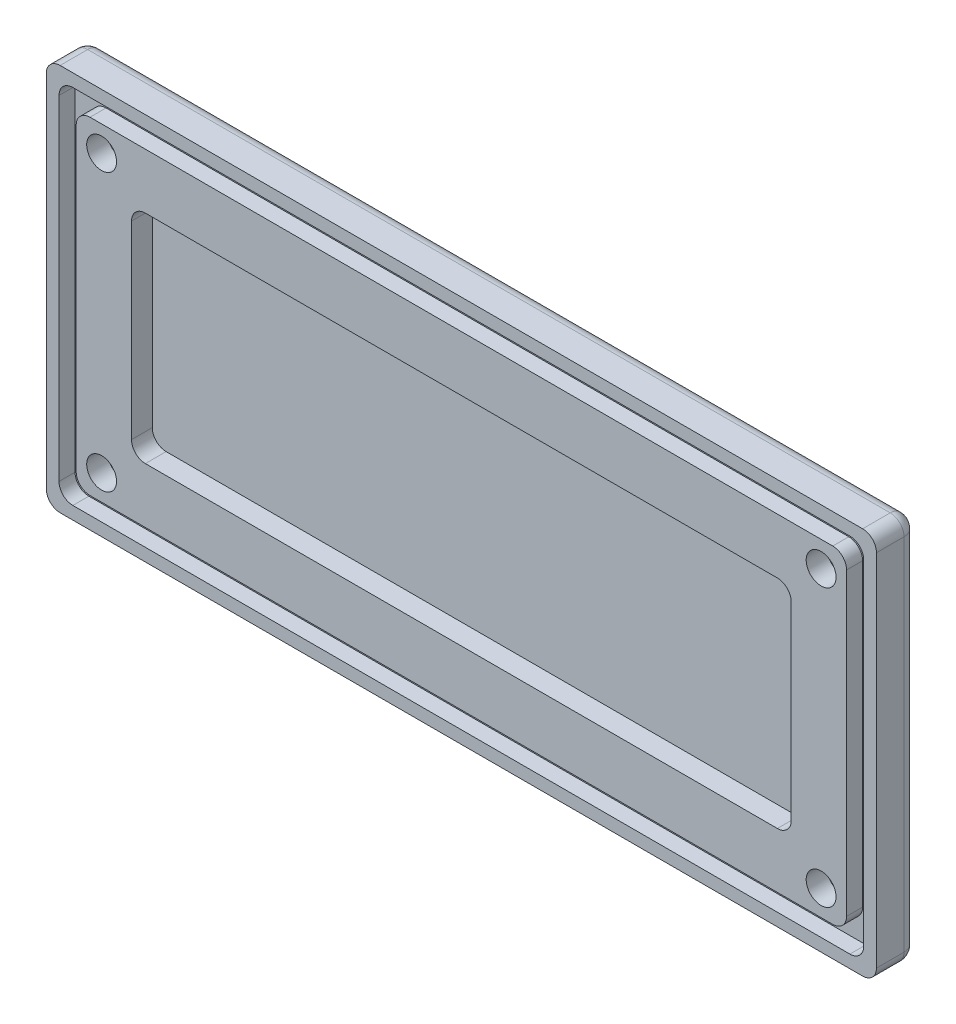
from build123d import *

# Parameters (mm, degrees)
SKETCH1_W                                  = 95.25
SKETCH1_H                                  = 44.45
BOSS_EXTRUDE1_DEPTH                        = 4.75
CUT_EXTRUDE1_DEPTH                         = 1.84
CUT_EXTRUDE2_DEPTH                         = 2.38
SKETCH4_R                                  = 1.714999999
CUT_EXTRUDE3_DEPTH                         = 53.769818552
SKETCH5_R                                  = 3.05
CUT_EXTRUDE4_DEPTH                         = 2.38
MIRROR1_AT_THE_SECOND_PLANE_COPY_1_SKETC_R = 1.714999999
MIRROR1_AT_THE_SECOND_PLANE_COPY_1_DEPTH   = 53.769818552
MIRROR1_AT_THE_SECOND_PLANE_COPY_2_SKETC_R = 3.05
MIRROR1_AT_THE_SECOND_PLANE_COPY_2_DEPTH   = 2.38
FILLET1_R                                  = 1.5875


with BuildPart() as part:
    # Sketch1 → Boss-Extrude1 (new body)
    with BuildSketch(Plane.XY):
        Rectangle(SKETCH1_W, SKETCH1_H)
    extrude(amount=BOSS_EXTRUDE1_DEPTH)

    # Sketch2 → Cut-Extrude1 (cut)
    with BuildSketch(Plane.XY.offset(4.75)):
        with BuildLine():
            ThreePointArc((-46.165, 19.1775), (-45.700032015, 20.300032015), (-44.5775, 20.765))
            Line((-44.5775, 20.765), (44.5775, 20.765))
            ThreePointArc((44.5775, 20.765), (45.700032015, 20.300032015), (46.165, 19.1775))
            Line((46.165, 19.1775), (46.165, -19.1775))
            ThreePointArc((46.165, -19.1775), (45.700032015, -20.300032015), (44.5775, -20.765))
            Line((44.5775, -20.765), (-44.5775, -20.765))
            ThreePointArc((-44.5775, -20.765), (-45.700032015, -20.300032015), (-46.165, -19.1775))
            Line((-46.165, -19.1775), (-46.165, 19.1775))
        make_face()
        with BuildLine():
            Line((-44.195, -17.2075), (-44.195, 17.2075))
            ThreePointArc((-44.195, 17.2075), (-43.730032015, 18.330032015), (-42.6075, 18.795))
            Line((-42.6075, 18.795), (42.6075, 18.795))
            ThreePointArc((42.6075, 18.795), (43.730032015, 18.330032015), (44.195, 17.2075))
            Line((44.195, 17.2075), (44.195, -17.2075))
            ThreePointArc((44.195, -17.2075), (43.730032015, -18.330032015), (42.6075, -18.795))
            Line((42.6075, -18.795), (-42.6075, -18.795))
            ThreePointArc((-42.6075, -18.795), (-43.730032015, -18.330032015), (-44.195, -17.2075))
        make_face(mode=Mode.SUBTRACT)
    extrude(amount=-CUT_EXTRUDE1_DEPTH, mode=Mode.SUBTRACT)

    # Sketch3 → Cut-Extrude2 (cut)
    with BuildSketch(Plane.XY.offset(4.75)):
        with BuildLine():
            Line((-36.257500002, 12.445), (36.257500002, 12.445))
            ThreePointArc((36.257500002, 12.445), (37.380032017, 11.980032015), (37.845000002, 10.8575))
            Line((37.845000002, 10.8575), (37.845000002, -10.8575))
            ThreePointArc((37.845000002, -10.8575), (37.380032017, -11.980032015), (36.257500002, -12.445))
            Line((36.257500002, -12.445), (-36.257500002, -12.445))
            ThreePointArc((-36.257500002, -12.445), (-37.380032017, -11.980032015), (-37.845000002, -10.8575))
            Line((-37.845000002, -10.8575), (-37.845000002, 10.8575))
            ThreePointArc((-37.845000002, 10.8575), (-37.380032017, 11.980032015), (-36.257500002, 12.445))
        make_face()
    extrude(amount=-CUT_EXTRUDE2_DEPTH, mode=Mode.SUBTRACT)

    # Sketch4 → Cut-Extrude3 (cut, through all)
    with BuildSketch(Plane.XY.offset(4.75)):
        with Locations((-41.275, 15.875)):
            Circle(SKETCH4_R)
    cut_extrude3 = extrude(amount=-CUT_EXTRUDE3_DEPTH, mode=Mode.SUBTRACT)

    # Sketch5 → Cut-Extrude4 (cut)
    with BuildSketch(Plane(origin=(0, 0, 0), x_dir=(-1, 0, 0), z_dir=(0, 0, -1))):
        with Locations((41.275, 15.875)):
            Circle(SKETCH5_R)
    cut_extrude4 = extrude(amount=-CUT_EXTRUDE4_DEPTH, mode=Mode.SUBTRACT)

    # Mirror1: Cut-Extrude3, Cut-Extrude4 across plane
    add(cut_extrude3.mirror(Plane(origin=(0, 0, 0), x_dir=(0, 0, 1), z_dir=(1, 0, 0))), mode=Mode.SUBTRACT)
    add(cut_extrude4.mirror(Plane(origin=(0, 0, 0), x_dir=(0, 0, 1), z_dir=(1, 0, 0))), mode=Mode.SUBTRACT)

    # Mirror1 at the second plane: Cut-Extrude3, Cut-Extrude4 across plane
    add(cut_extrude3.mirror(Plane.ZX), mode=Mode.SUBTRACT)
    add(cut_extrude4.mirror(Plane.ZX), mode=Mode.SUBTRACT)

    # Mirror1 at the second plane copy 1 sketc → Mirror1 at the second plane copy 1 (cut, through all)
    with BuildSketch(Plane(origin=(0, 0, 4.75), x_dir=(-1, 0, 0), z_dir=(0, 0, 1))):
        with Locations((-41.275, 15.875)):
            Circle(MIRROR1_AT_THE_SECOND_PLANE_COPY_1_SKETC_R)
    extrude(amount=-MIRROR1_AT_THE_SECOND_PLANE_COPY_1_DEPTH, mode=Mode.SUBTRACT)

    # Mirror1 at the second plane copy 2 sketc → Mirror1 at the second plane copy 2 (cut)
    with BuildSketch(Plane(origin=(0, 0, 0), x_dir=(1, 0, 0), z_dir=(0, 0, -1))):
        with Locations((41.275, 15.875)):
            Circle(MIRROR1_AT_THE_SECOND_PLANE_COPY_2_SKETC_R)
    extrude(amount=-MIRROR1_AT_THE_SECOND_PLANE_COPY_2_DEPTH, mode=Mode.SUBTRACT)

    # Fillet1
    fillet1_edges = [part.edges().sort_by_distance(p)[0] for p in [
        (0, -22.225, 0),
        (-47.625, 0, 0),
        (0, 22.225, 0),
        (47.625, 0, 0),
        (47.625, -22.225, 2.375),
        (-47.625, -22.225, 2.375),
        (-47.625, 22.225, 2.375),
        (47.625, 22.225, 2.375),
    ]]
    fillet(fillet1_edges, radius=FILLET1_R)


solid = part.part
